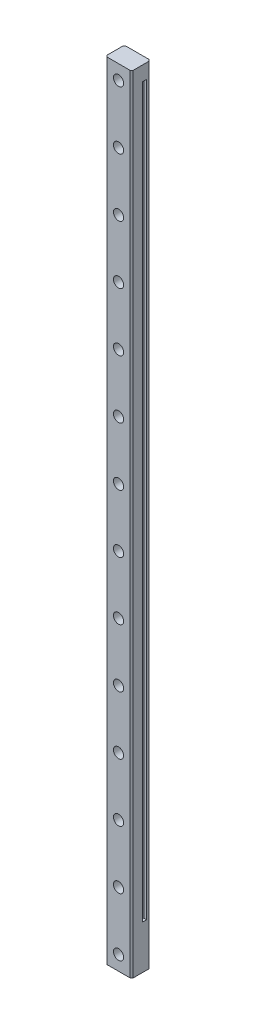
from build123d import *

# Parameters (mm, degrees)
EXTRUDE_1_DEPTH          = 130
EXTRUDE_1_DEPTH_BACK     = 140
SKETCH_1_W               = 9
SKETCH_1_H               = 6.5
CUT_EXTRUDE_1_DEPTH      = 125
CUT_EXTRUDE_1_DEPTH_BACK = 125
SKETCH_2_W               = 0.95
SKETCH_2_H               = 1.48
CHAMFER_2_SIZE           = 0.5
SKETCH_3_R               = 3
CUT_EXTRUDE_2_DEPTH      = 3.5
SKETCH_4_R               = 1.75
CUT_EXTRUDE_3_DEPTH      = 5


with BuildPart() as part:
    # 草图1 → 凸台-拉伸1 (new, two sides: drawn at the far end of the back side and taken through both)
    with BuildSketch(Plane(origin=(0, 0, 0), x_dir=(1, 0, 0), z_dir=(0, 1, 0)).offset(-EXTRUDE_1_DEPTH_BACK)):
        Rectangle(SKETCH_1_W, SKETCH_1_H)
    extrude(amount=EXTRUDE_1_DEPTH + EXTRUDE_1_DEPTH_BACK)

    # 草图2 → 切除-拉伸1 (cut, two sides: drawn at the far end of the back side and taken through both)
    with BuildSketch(Plane(origin=(0, 0, 0), x_dir=(1, 0, 0), z_dir=(0, 1, 0)).offset(-CUT_EXTRUDE_1_DEPTH_BACK)):
        with Locations((4.025, 1.15)):
            Rectangle(SKETCH_2_W, SKETCH_2_H)
        with Locations((-4.025, 1.15)):
            Rectangle(SKETCH_2_W, SKETCH_2_H)
    extrude(amount=CUT_EXTRUDE_1_DEPTH + CUT_EXTRUDE_1_DEPTH_BACK, mode=Mode.SUBTRACT)

    # 倒角2
    chamfer_2_edges = [part.edges().sort_by_distance(p)[0] for p in [
        (4.5, -5, 3.25),
        (-4.5, -5, 3.25),
        (-4.5, -5, -3.25),
        (4.5, -5, -3.25),
    ]]
    chamfer(chamfer_2_edges, length=CHAMFER_2_SIZE)

    # 草图3 → 切除-拉伸2 (cut)
    with BuildSketch(Plane(origin=(0, 0, -3.25), x_dir=(-1, 0, 0), z_dir=(0, 0, -1))):
        with Locations((0, -135)):
            Circle(SKETCH_3_R)
        with Locations((0, -115)):
            Circle(SKETCH_3_R)
        with Locations((0, -95)):
            Circle(SKETCH_3_R)
        with Locations((0, -75)):
            Circle(SKETCH_3_R)
        with Locations((0, -55)):
            Circle(SKETCH_3_R)
        with Locations((0, -35)):
            Circle(SKETCH_3_R)
        with Locations((0, -15)):
            Circle(SKETCH_3_R)
        with Locations((0, 5)):
            Circle(SKETCH_3_R)
        with Locations((0, 25)):
            Circle(SKETCH_3_R)
        with Locations((0, 45)):
            Circle(SKETCH_3_R)
        with Locations((0, 65)):
            Circle(SKETCH_3_R)
        with Locations((0, 85)):
            Circle(SKETCH_3_R)
        with Locations((0, 105)):
            Circle(SKETCH_3_R)
        with Locations((0, 125)):
            Circle(SKETCH_3_R)
    extrude(amount=-CUT_EXTRUDE_2_DEPTH, mode=Mode.SUBTRACT)

    # 草图4 → 切除-拉伸3 (cut)
    with BuildSketch(Plane(origin=(0, 0, 0.25), x_dir=(-1, 0, 0), z_dir=(0, 0, -1))):
        with Locations((0, -135)):
            Circle(SKETCH_4_R)
        with Locations((0, -115)):
            Circle(SKETCH_4_R)
        with Locations((0, -95)):
            Circle(SKETCH_4_R)
        with Locations((0, -75)):
            Circle(SKETCH_4_R)
        with Locations((0, -55)):
            Circle(SKETCH_4_R)
        with Locations((0, -35)):
            Circle(SKETCH_4_R)
        with Locations((0, -15)):
            Circle(SKETCH_4_R)
        with Locations((0, 5)):
            Circle(SKETCH_4_R)
        with Locations((0, 25)):
            Circle(SKETCH_4_R)
        with Locations((0, 45)):
            Circle(SKETCH_4_R)
        with Locations((0, 65)):
            Circle(SKETCH_4_R)
        with Locations((0, 85)):
            Circle(SKETCH_4_R)
        with Locations((0, 105)):
            Circle(SKETCH_4_R)
        with Locations((0, 125)):
            Circle(SKETCH_4_R)
        with Locations((0, 145)):
            Circle(SKETCH_4_R)
    extrude(amount=-CUT_EXTRUDE_3_DEPTH, mode=Mode.SUBTRACT)


solid = part.part
